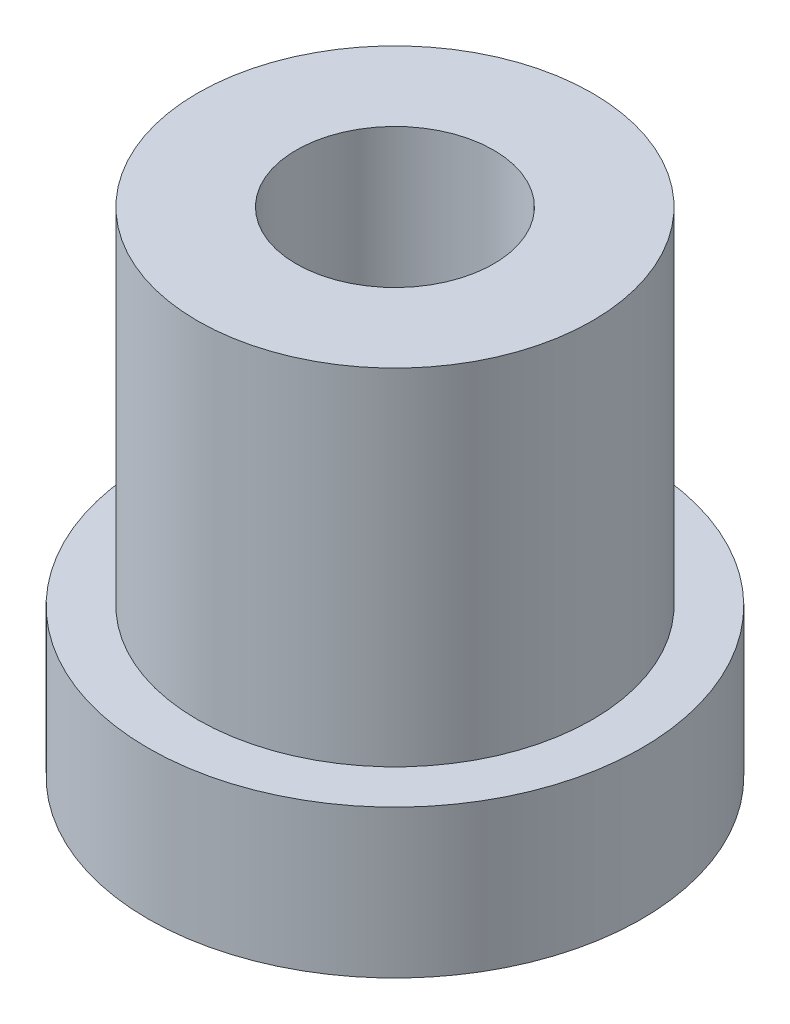
from build123d import *

# Parameters (mm, degrees)
SKETCH2_R           = 8
BOSS_EXTRUDE1_DEPTH = 20
SKETCH3_R           = 10
BOSS_EXTRUDE2_DEPTH = 6
SKETCH1_R           = 4
CUT_EXTRUDE1_DEPTH  = 25.494897428


with BuildPart() as part:
    # Sketch2 → Boss-Extrude1 (new body)
    with BuildSketch(Plane(origin=(0, 0, 0), x_dir=(1, 0, 0), z_dir=(0, 1, 0))):
        with Locations(Location((0, 0, 0), (0, 0, 270))):
            Circle(SKETCH2_R)
    extrude(amount=BOSS_EXTRUDE1_DEPTH)

    # Sketch3 → Boss-Extrude2 (add)
    with BuildSketch(Plane(origin=(0, 0, 0), x_dir=(1, 0, 0), z_dir=(0, 1, 0))):
        with Locations(Location((0, 0, 0), (0, 0, 270))):
            Circle(SKETCH3_R)
    extrude(amount=BOSS_EXTRUDE2_DEPTH)

    # Sketch1 → Cut-Extrude1 (cut, through all)
    with BuildSketch(Plane(origin=(0, 0, 0), x_dir=(1, 0, 0), z_dir=(0, 1, 0))):
        with Locations(Location((0, 0, 0), (0, 0, 270))):
            Circle(SKETCH1_R)
    extrude(amount=CUT_EXTRUDE1_DEPTH, mode=Mode.SUBTRACT)


solid = part.part
